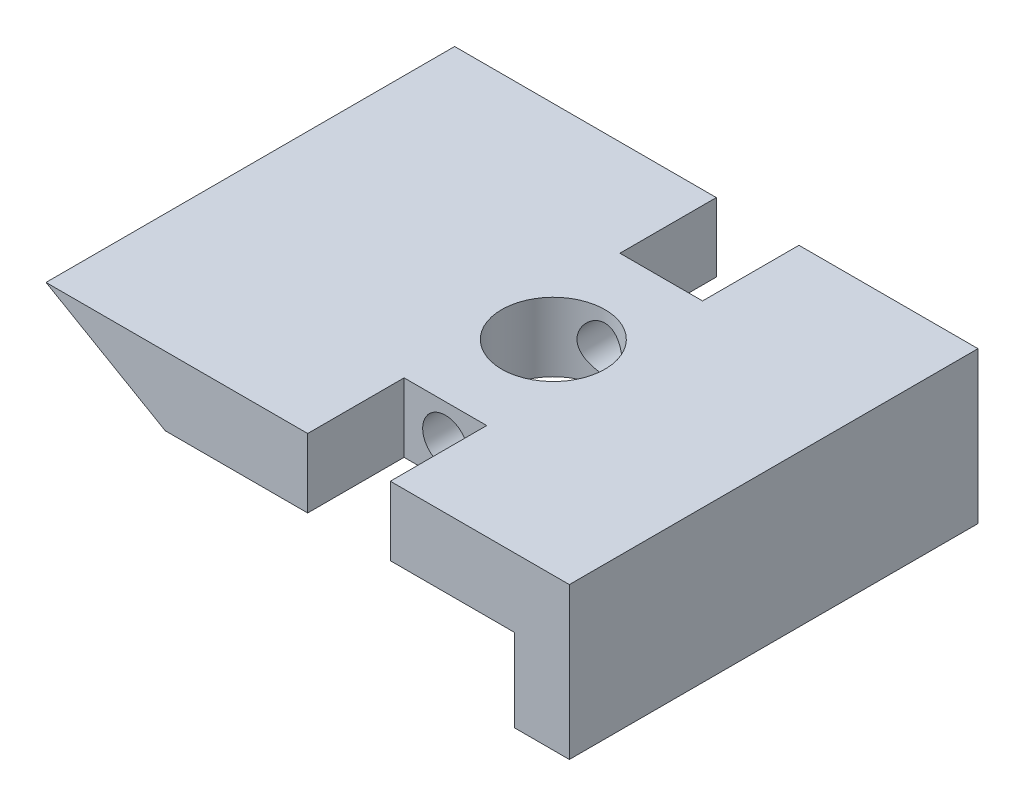
from build123d import *

# Parameters (mm, degrees)
BOSS_EXTRUDE1_DEPTH = 14.835
CUT_EXTRUDE1_REACH  = 37.321
SKETCH4_R           = 1.65
SKETCH4_3_W         = 6
SKETCH4_3_H         = 5
SKETCH4_3_R         = 1.65
CUT_EXTRUDE3_DEPTH  = 7
CUT_EXTRUDE2_REACH  = 26.619
SKETCH5_R           = 3.75
SKETCH6_W           = 4
SKETCH6_H           = 6
BOSS_EXTRUDE2_DEPTH = 29.67


with BuildPart() as part:
    # Sketch3 → Boss-Extrude1 (new, symmetric)
    with BuildSketch(Plane.XY):
        Polygon((-19, 2.5), (-10.339745962, -2.5), (19, -2.5), (19, 2.5), align=None)
    extrude(amount=BOSS_EXTRUDE1_DEPTH, both=True)

    # Sketch4 → Cut-Extrude1 (cut, up to next)
    with BuildSketch(Plane.XY.offset(14.835), mode=Mode.PRIVATE) as cut_extrude1_sk1:
        with Locations((3, 0)):
            Circle(SKETCH4_R)
    cut_extrude1_tool1 = extrude(cut_extrude1_sk1.sketch, amount=-CUT_EXTRUDE1_REACH, mode=Mode.PRIVATE) & part.part
    add(cut_extrude1_tool1.solids().sort_by_distance((3, 0, 14.835))[0], mode=Mode.SUBTRACT)

    # Sketch4<3> → Cut-Extrude3 (cut)
    with BuildSketch(Plane.XY.offset(14.835)):
        with Locations((3, 0)):
            Rectangle(SKETCH4_3_W, SKETCH4_3_H)
        with Locations((3, 0)):
            Circle(SKETCH4_3_R, mode=Mode.SUBTRACT)
    cut_extrude3 = extrude(amount=-CUT_EXTRUDE3_DEPTH, mode=Mode.SUBTRACT)

    # Mirror1: Cut-Extrude3 across plane
    add(cut_extrude3.mirror(Plane.XY), mode=Mode.SUBTRACT)

    # Sketch5 → Cut-Extrude2 (cut, up to next)
    with BuildSketch(Plane(origin=(0, 2.5, 0), x_dir=(1, 0, 0), z_dir=(0, 1, 0)), mode=Mode.PRIVATE) as cut_extrude2_sk1:
        with Locations(Location((3, 0, 0), (0, 0, 270))):
            Circle(SKETCH5_R)
    cut_extrude2_tool1 = extrude(cut_extrude2_sk1.sketch, amount=-CUT_EXTRUDE2_REACH, mode=Mode.PRIVATE) & part.part
    add(cut_extrude2_tool1.solids().sort_by_distance((3, 2.5, 0))[0], mode=Mode.SUBTRACT)

    # Sketch6 → Boss-Extrude2 (add)
    with BuildSketch(Plane.XY.offset(14.835)):
        with Locations((17, -5.5)):
            Rectangle(SKETCH6_W, SKETCH6_H)
    extrude(amount=-BOSS_EXTRUDE2_DEPTH)


solid = part.part
